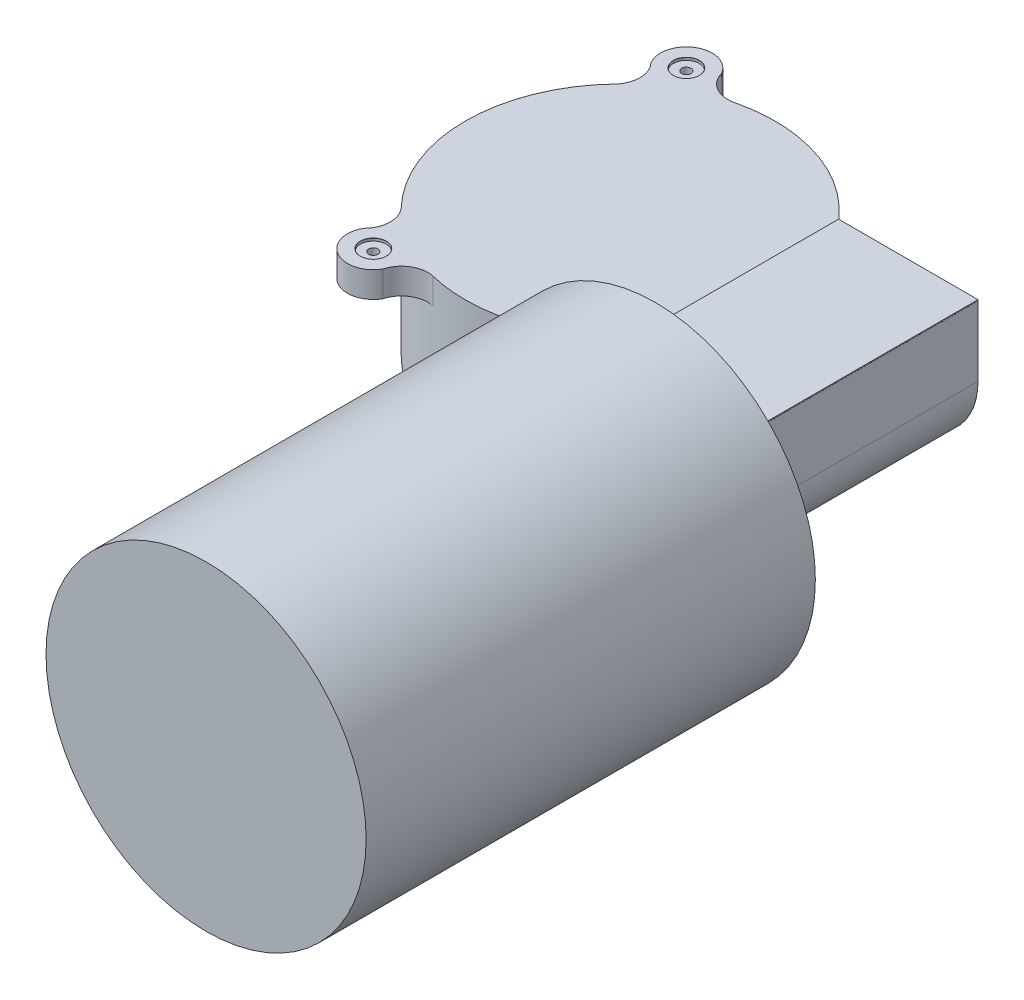
from build123d import *

# Parameters (mm, degrees)
SKETCH1_R                                    = 31
BOSS_EXTRUDE1_DEPTH                          = 87
BOSS_EXTRUDE2_DEPTH                          = 49
SKETCH4_R                                    = 30
BOSS_EXTRUDE35_DEPTH                         = 24.5
SKETCH12_R                                   = 1.5875
SKETCH12_R_2                                 = 0.79375
BOSS_EXTRUDE36_DEPTH                         = 17.5
SKETCH14_R                                   = 5
BOSS_EXTRUDE37_DEPTH                         = 17.5
BOSS_EXTRUDE38_DEPTH                         = 3.175
SKETCH17_R                                   = 3
BOSS_EXTRUDE39_DEPTH                         = 3.188
BOSS_EXTRUDE40_DEPTH                         = 5
CBORE_FOR_M1_6_HEXAGON_HEAD_BOLTS_FU_2_COUNT = 2
CBORE_FOR_M1_6_HEXAGON_HEAD_BOLTS_FU_2_PITCH = 60.621778265
SKETCH23_W                                   = 27
SKETCH23_H                                   = 0.198523496
BOSS_EXTRUDE44_DEPTH                         = 49


with BuildPart() as part:
    # Sketch1 → Boss-Extrude1 (new body)
    with BuildSketch(Plane.XY):
        Circle(SKETCH1_R)
    extrude(amount=BOSS_EXTRUDE1_DEPTH)

    # Sketch2 → Boss-Extrude2 (add)
    with BuildSketch(Plane.XY):
        with BuildLine():
            Line((-2.6e-08, 13.5), (-13.5, 13.5))
            Line((-13.5, 13.5), (-13.5, 0))
            ThreePointArc((-13.5, 0), (-9.545941555, 9.545941537), (-2.6e-08, 13.5))
        make_face()
        with BuildLine():
            Line((13.5, 13.5), (-2.6e-08, 13.5))
            ThreePointArc((-2.6e-08, 13.5), (9.545941537, 9.545941555), (13.5, 0))
            Line((13.5, 0), (13.5, 13.5))
        make_face()
        with BuildLine():
            ThreePointArc((13.5, 0), (9.545941537, 9.545941555), (-2.6e-08, 13.5))
            ThreePointArc((-2.6e-08, 13.5), (-9.545941555, 9.545941537), (-13.5, 0))
            Line((-13.5, 0), (13.5, 0))
        make_face()
        with BuildLine():
            Line((13.5, 0), (-13.5, 0))
            ThreePointArc((-13.5, 0), (0, -13.5), (13.5, 0))
        make_face()
    extrude(amount=-BOSS_EXTRUDE2_DEPTH)

    # Sketch23 → Boss-Extrude44 (add)
    with BuildSketch(Plane(origin=(0, 0, 0), x_dir=(-1, 0, 0), z_dir=(0, 0, -1))):
        with Locations((0, 13.614545632)):
            Rectangle(SKETCH23_W, SKETCH23_H)
    extrude(amount=BOSS_EXTRUDE44_DEPTH)


with BuildPart() as body_2:
    # Sketch4 → Boss-Extrude35 (new body)
    with BuildSketch(Plane(origin=(0, 13.5, 0), x_dir=(1, 0, 0), z_dir=(0, 1, 0))):
        with Locations(Location((-36.319116719, 29.524684542, 0), (0, 0, 270))):
            Circle(SKETCH4_R)
    extrude(amount=-BOSS_EXTRUDE35_DEPTH)

    # Sketch12 → Boss-Extrude36 (add)
    # profile 1 of 3: a face of its own
    with BuildSketch(Plane.XZ.offset(11)):
        with Locations(Location((-41.081616719, -21.275792571, 0), (0, 0, 90))):
            Circle(SKETCH12_R)
        with Locations(Location((-41.081616719, -21.275792571, 0), (0, 0, 270))):
            Circle(SKETCH12_R_2, mode=Mode.SUBTRACT)
    # profile 2 of 3: a face of its own
    with BuildSketch(Plane.XZ.offset(11)):
        with Locations(Location((-26.794116719, -29.524684542, 0), (0, 0, 90))):
            Circle(SKETCH12_R)
        with Locations(Location((-26.794116719, -29.524684542, 0), (0, 0, 270))):
            Circle(SKETCH12_R_2, mode=Mode.SUBTRACT)
    # profile 3 of 3: a face of its own
    with BuildSketch(Plane.XZ.offset(11)):
        with Locations(Location((-41.081616719, -37.773576513, 0), (0, 0, 90))):
            Circle(SKETCH12_R)
        with Locations(Location((-41.081616719, -37.773576513, 0), (0, 0, 270))):
            Circle(SKETCH12_R_2, mode=Mode.SUBTRACT)
    extrude(amount=BOSS_EXTRUDE36_DEPTH)

    # Sketch14 → Boss-Extrude37 (add)
    with BuildSketch(Plane.XZ.offset(11)):
        with Locations(Location((-36.319116719, -29.524684542, 0), (0, 0, 90))):
            Circle(SKETCH14_R)
    extrude(amount=BOSS_EXTRUDE37_DEPTH)

    # Sketch16 → Boss-Extrude38 (add)
    with BuildSketch(Plane.XZ.offset(28.5)):
        with BuildLine():
            Line((-39.819112112, -27.588184542), (-39.819112112, -31.461184542))
            ThreePointArc((-39.819112112, -31.461184542), (-36.319116719, -33.524684542), (-32.819121326, -31.461184542))
            Line((-32.819121326, -31.461184542), (-32.819121326, -27.588184542))
            ThreePointArc((-32.819121326, -27.588184542), (-36.319116719, -25.524684542), (-39.819112112, -27.588184542))
        make_face()
    extrude(amount=BOSS_EXTRUDE38_DEPTH)

    # Sketch17 → Boss-Extrude39 (add)
    with BuildSketch(Plane.XZ.offset(31.675)):
        with Locations(Location((-36.319116719, -29.524684542, 0), (0, 0, 270))):
            Circle(SKETCH17_R)
    extrude(amount=BOSS_EXTRUDE39_DEPTH)

    # Sketch4<14> → Boss-Extrude40 (add)
    with BuildSketch(Plane(origin=(0, 13.5, 0), x_dir=(1, 0, 0), z_dir=(0, 1, 0))):
        with BuildLine():
            ThreePointArc((-57.409928714, 56.356195969), (-54.510789615, 54.883645908), (-51.319116839, 55.505446587))
            ThreePointArc((-51.319116839, 55.505446587), (-49.488989735, 57.335573615), (-48.819116719, 59.835573675))
            ThreePointArc((-48.819116719, 59.835573675), (-48.86169446, 60.486699273), (-48.988702537, 61.126735489))
            ThreePointArc((-48.988702537, 61.126735489), (-49.277543837, 61.715139228), (-49.4889897, 62.335573675))
            ThreePointArc((-49.4889897, 62.335573675), (-56.358669983, 64.142622458), (-58.102725979, 57.25668017))
            ThreePointArc((-58.102725979, 57.25668017), (-57.731278879, 56.825709379), (-57.409928714, 56.356195969))
        make_face()
        with BuildLine():
            ThreePointArc((-57.985399102, 50.274918462), (-54.837855182, 53.126725254), (-51.319116839, 55.505446587))
            ThreePointArc((-51.319116839, 55.505446587), (-54.510789615, 54.883645908), (-57.409928714, 56.356195969))
            ThreePointArc((-57.409928714, 56.356195969), (-56.691759054, 53.220368588), (-57.985399102, 50.274918462))
        make_face()
        with BuildLine():
            ThreePointArc((-51.319116839, 55.505446587), (-47.510939371, 57.358892017), (-43.479702964, 58.657586983))
            ThreePointArc((-43.479702964, 58.657586983), (-46.635919955, 58.995876585), (-48.988702537, 61.126735489))
            ThreePointArc((-48.988702537, 61.126735489), (-48.86169446, 60.486699273), (-48.819116719, 59.835573675))
            ThreePointArc((-48.819116719, 59.835573675), (-49.488989735, 57.335573615), (-51.319116839, 55.505446587))
        make_face()
        with BuildLine():
            ThreePointArc((-48.819116719, -0.78620459), (-49.488989743, 1.713795484), (-51.319116868, 3.543922515))
            ThreePointArc((-51.319116868, 3.543922515), (-54.470242402, 4.171217658), (-57.352502741, 2.751475895))
            ThreePointArc((-57.352502741, 2.751475895), (-57.717654677, 2.207130123), (-58.149243738, 1.71379541))
            ThreePointArc((-58.149243738, 1.71379541), (-56.319116719, -5.116331609), (-49.4889897, -3.28620459))
            ThreePointArc((-49.4889897, -3.28620459), (-49.277543837, -2.665770143), (-48.988702537, -2.077366404))
            ThreePointArc((-48.988702537, -2.077366404), (-48.86169446, -1.437330188), (-48.819116719, -0.78620459))
        make_face()
        with BuildLine():
            ThreePointArc((-48.988702537, -2.077366404), (-46.635919955, 0.0534925), (-43.479702964, 0.391782102))
            ThreePointArc((-43.479702964, 0.391782102), (-47.510939387, 1.690477074), (-51.319116868, 3.543922515))
            ThreePointArc((-51.319116868, 3.543922515), (-49.488989743, 1.713795484), (-48.819116719, -0.78620459))
            ThreePointArc((-48.819116719, -0.78620459), (-48.86169446, -1.437330188), (-48.988702537, -2.077366404))
        make_face()
        with BuildLine():
            ThreePointArc((-57.352502741, 2.751475895), (-54.470242402, 4.171217658), (-51.319116868, 3.543922515))
            ThreePointArc((-51.319116868, 3.543922515), (-54.828336282, 5.91517817), (-57.968657196, 8.756983728))
            ThreePointArc((-57.968657196, 8.756983728), (-56.68351609, 5.854474833), (-57.352502741, 2.751475895))
        make_face()
    extrude(amount=-BOSS_EXTRUDE40_DEPTH)

    # Sketch21 → CBORE for M1.6 Hexagon head bolts-Full thread-grades AB1 (revolve, cut)
    with BuildSketch(Plane(origin=(-53.819116719, 13.5, -59.835573675), x_dir=(0, 0, 1), z_dir=(1, 0, 0))):
        Polygon((0, 0), (0, 5.001), (0.9, 5.001), (0.9, 0.5), (2.5, 0.5), (2.5, 0.025), (2.525, 0), align=None)
    cbore_for_m1_6_hexagon_head_bolts_full_t = revolve(axis=Axis((-53.819116719, 19.85, -59.835573675), (0, -1, 0)), mode=Mode.SUBTRACT)

    # CBORE for M1.6 Hexagon head bolts-Fu 2: CBORE for M1.6 Hexagon head bolts-Full thread-grades AB1 ×2
    with Locations(*[(0, 0, i * CBORE_FOR_M1_6_HEXAGON_HEAD_BOLTS_FU_2_PITCH) for i in range(1, CBORE_FOR_M1_6_HEXAGON_HEAD_BOLTS_FU_2_COUNT)]):
        add(cbore_for_m1_6_hexagon_head_bolts_full_t, mode=Mode.SUBTRACT)


solid = Compound([part.part, body_2.part])
